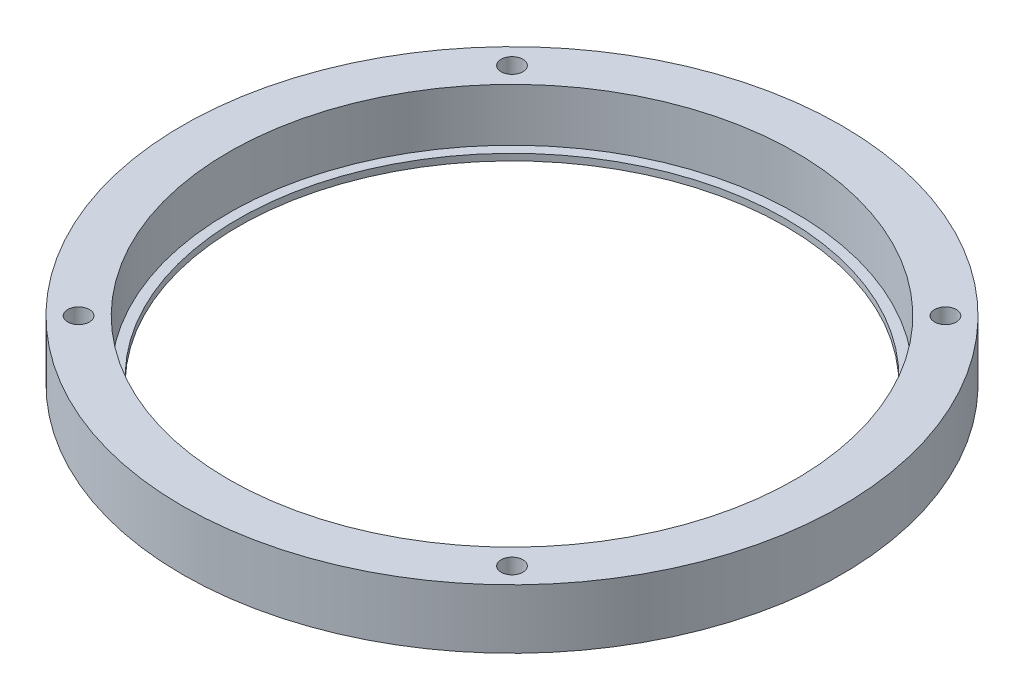
from build123d import *

# Parameters (mm, degrees)
SKETCH_2_R         = 50
SKETCH_2_R_2       = 43
EXTRUDE_1_DEPTH    = 8
EXTRUDE_START      = 1
SKETCH_3_R         = 50
SKETCH_3_R_2       = 41.5
EXTRUDE_2_DEPTH    = 1
HOLE_WIZARD_M4_1_D = 3.3


with BuildPart() as part:
    # 草图2 → 凸台-拉伸1 (new body)
    with BuildSketch(Plane(origin=(0, 0, 0), x_dir=(1, 0, 0), z_dir=(0, 1, 0))):
        with Locations(Location((0, 0, 0), (0, 0, 270))):
            Circle(SKETCH_2_R)
        with Locations(Location((0, 0, 0), (0, 0, 270))):
            Circle(SKETCH_2_R_2, mode=Mode.SUBTRACT)
    extrude(amount=EXTRUDE_1_DEPTH)

    # 草图3 → 凸台-拉伸2 (add)
    with BuildSketch(Plane.XZ.offset(EXTRUDE_START)):
        with Locations(Location((0, 0, 0), (0, 0, 270))):
            Circle(SKETCH_3_R)
        with Locations(Location((0, 0, 0), (0, 0, 270))):
            Circle(SKETCH_3_R_2, mode=Mode.SUBTRACT)
    extrude(amount=-EXTRUDE_2_DEPTH)

    # M4 螺纹孔1 (through all)
    with Locations(Plane(origin=(0, 8, 0), x_dir=(1, 0, 0), z_dir=(0, 1, 0))):
        with Locations((-32.880465325, 32.880465325), (-32.880465325, -32.880465325), (32.880465325, -32.880465325), (32.880465325, 32.880465325)):
            Hole(HOLE_WIZARD_M4_1_D / 2)


solid = part.part
